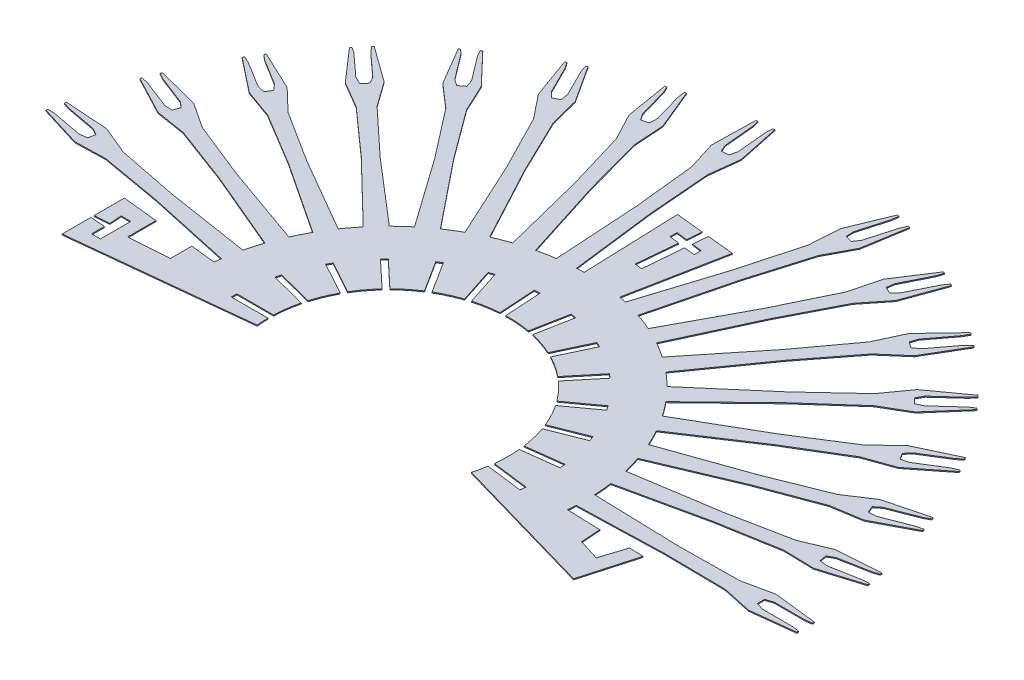
from build123d import *

# Parameters (mm, degrees)
SKETCH2_R               = 6.200163369
BOSS_EXTRUDE1_DEPTH     = 0.05
BOSS_EXTRUDE2_DEPTH     = 0.05
BOSS_EXTRUDE3_DEPTH     = 0.05
CIRPATTERN1_COUNT       = 18
CIRPATTERN1_ANGLE       = 180
CUT_EXTRUDE4_DEPTH      = 103.361408091
CUT_EXTRUDE4_DEPTH_BACK = 0.05
CUT_EXTRUDE6_DEPTH      = 103.361408091
CUT_EXTRUDE6_DEPTH_BACK = 0.05
CUT_EXTRUDE13_DEPTH     = 10
SKETCH13_R              = 2.29112386
SKETCH13_W              = 5.561420579
SKETCH13_H              = 0.286113496
CUT_EXTRUDE14_DEPTH     = 103.361408091


with BuildPart() as part:
    # Sketch2 → Boss-Extrude1 (new body)
    with BuildSketch(Plane(origin=(0, 0, 0), x_dir=(1, 0, 0), z_dir=(0, 1, 0))):
        with BuildLine():
            Line((41.736564116, 50.95828476), (36.555246465, 51.501399508))
            Line((36.555246465, 51.501399508), (36.555246465, 48.286890075))
            Line((36.555246465, 48.286890075), (41.732722408, 48.833722572))
            ThreePointArc((41.732722408, 48.833722572), (41.733244647, 48.828783324), (41.733769301, 48.82384433))
            ThreePointArc((41.733769301, 48.82384433), (50.963390645, 39.773597615), (61.612393233, 47.101054176))
            Line((61.612393233, 47.101054176), (66.500703475, 45.70083261))
            Line((66.500703475, 45.70083261), (67.011967053, 48.840095645))
            Line((67.011967053, 48.840095645), (61.960868148, 49.001189769))
            ThreePointArc((61.960868148, 49.001189769), (59.963353335, 56.003029367), (53.794021492, 59.87022057))
            Line((53.794021492, 59.87022057), (54.740102943, 64.742398272))
            Line((54.740102943, 64.742398272), (51.585987879, 65.064191003))
            Line((51.585987879, 65.064191003), (51.764987526, 60.059419928))
            ThreePointArc((51.764987526, 60.059419928), (45.016500937, 57.426340658), (41.737479755, 50.966991019))
            ThreePointArc((41.737479755, 50.966991019), (41.737020998, 50.962637988), (41.736564116, 50.95828476))
        make_face()
        with Locations(Location((51.841, 49.9, 0), (0, 0, 270))):
            Circle(SKETCH2_R, mode=Mode.SUBTRACT)
    extrude(amount=BOSS_EXTRUDE1_DEPTH)

    # Sketch3 → Boss-Extrude2 (add)
    with BuildSketch(Plane(origin=(0, 0, 0), x_dir=(1, 0, 0), z_dir=(0, 1, 0))):
        Polygon((32.238549372, 50.21), (30.656382721, 50.21), (30.312927172, 50.258547235), (30.312927172, 50.353802971), (32.548549372, 50.609778247), (34.08565504, 50.281862639), (37.255402915, 50.243744905), (41.857469478, 50.381755064), (41.857469478, 49.418244936), (37.255402915, 49.556255095), (34.08565504, 49.518137361), (32.548549372, 49.190221753), (30.312927172, 49.446197029), (30.312927172, 49.541452765), (30.656382721, 49.59), (32.238549372, 49.59), (32.615106949, 49.71386823), (32.615106949, 50.08613177), align=None)
    boss_extrude2 = extrude(amount=BOSS_EXTRUDE2_DEPTH)

    # CirPattern1: Boss-Extrude2 ×18 about axis
    cirpattern1_axis = Axis((51.841, 0, -49.9), (0, -1, 0))
    for i in range(1, CIRPATTERN1_COUNT):
        add(boss_extrude2.rotate(cirpattern1_axis, i * CIRPATTERN1_ANGLE / (CIRPATTERN1_COUNT - 1)))

    # Sketch8 → Cut-Extrude4 (cut, two sides: drawn at the far end of the back side and taken through both)
    with BuildSketch(Plane(origin=(0, 0, 0), x_dir=(1, 0, 0), z_dir=(0, 1, 0)).offset(-CUT_EXTRUDE4_DEPTH_BACK)):
        Polygon((36.555246465, 48.286890075), (27.995570216, 47.169676763), (27.995570216, 52.890741223), (36.555246465, 51.501399508), (36.555246465, 48.753981284), align=None)
        Polygon((51.655565612, 72.526598057), (51.585987879, 65.064191003), (54.740102943, 64.742398272), (56.406958129, 72.526598057), align=None)
        Polygon((47.95502979, 51.501399508), (46.998338953, 48.798), (52.839188276, 46.161429513), (54.740102943, 51.719098387), align=None)
    extrude(amount=CUT_EXTRUDE4_DEPTH + CUT_EXTRUDE4_DEPTH_BACK, mode=Mode.SUBTRACT)


with BuildPart() as body_2:
    # Sketch5 → Boss-Extrude3 (new body)
    with BuildSketch(Plane(origin=(0, 0, 0), x_dir=(1, 0, 0), z_dir=(0, 1, 0))):
        Polygon((51.841, 49.9), (51.841, 47.98601508), (47.518666367, 49.9), align=None)
    extrude(amount=BOSS_EXTRUDE3_DEPTH)


with BuildPart() as cut_extrude6_tool:
    # Sketch9 → Cut-Extrude6 (new, two sides: drawn at the far end of the back side and taken through both)
    with BuildSketch(Plane(origin=(0, 0, 0), x_dir=(1, 0, 0), z_dir=(0, 1, 0)).offset(-CUT_EXTRUDE6_DEPTH_BACK)):
        Polygon((36.555246465, 48.286890075), (47.009139853, 49.390092422), (47.587964148, 50.49093808), (51.841, 49.9), (66.500703475, 45.70083261), (51.841, 34.857894493), align=None)
    extrude(amount=CUT_EXTRUDE6_DEPTH + CUT_EXTRUDE6_DEPTH_BACK)


with BuildPart() as part_1:
    add(part.part)

    # Cut-Extrude6: cut by cut_extrude6_tool
    add(cut_extrude6_tool.part, mode=Mode.SUBTRACT)

    # Sketch12 → Cut-Extrude13 (cut)
    with BuildSketch(Plane(origin=(0, 0, 0), x_dir=(1, 0, 0), z_dir=(0, 1, 0))):
        Polygon((36.555246465, 51.501399508), (38.377437868, 51.501399508), (38.377437868, 49.846380566), (40.450129226, 49.985069668), (40.450129226, 51.16915959), (37.317153392, 51.720562063), align=None)
        Polygon((66.036768105, 49.006664529), (65.095153252, 45.671159721), (66.958125451, 45.145241638), (67.462296373, 48.891444034), align=None)
        Polygon((53.08254989, 66.12808357), (52.948117152, 64.171821775), (52.385771098, 64.24300482), (52.385771098, 63.878888302), (52.896048123, 63.814296274), (52.708350835, 61.754583122), (53.087715457, 61.700660527), (53.262410471, 63.755183921), (53.814395603, 63.698049757), (53.814395603, 64.054600552), (53.300329713, 64.12534266), (53.473842648, 66.014949594), align=None)
        Polygon((65.273932949, 48.895526569), (64.858820111, 47.588272269), (63.761063297, 47.936860104), (63.677982038, 49.064928372), (65.504842158, 49.006664529), align=None)
        Polygon((35.431152546, 49.858633501), (37.312510157, 49.997193872), (37.266298078, 50.624656446), (37.766087028, 50.624656446), (37.766087028, 49.051172586), (37.312510157, 49.051172586), (37.312510157, 49.715786798), align=None)
    extrude(amount=CUT_EXTRUDE13_DEPTH, mode=Mode.SUBTRACT)

    # Sketch13 → Cut-Extrude14 (cut, through all)
    with BuildSketch(Plane(origin=(0, 0, 0), x_dir=(1, 0, 0), z_dir=(0, 1, 0))):
        with Locations((51.841102424, 49.89933139)):
            Circle(SKETCH13_R)
        Polygon((49.373582939, 50.469956344), (43.986884615, 51.853025401), (44.058038148, 52.130150114), (49.444736472, 50.747081058), align=None)
        with Locations((46.528485657, 49.981438718)):
            Rectangle(SKETCH13_W, SKETCH13_H)
        Polygon((49.593013257, 51.065676254), (44.719503253, 53.744911051), (44.857339481, 53.995634219), (49.730849484, 51.316399422), align=None)
        Polygon((49.953699285, 51.588110427), (45.899598159, 55.395164789), (46.095456324, 55.603732551), (50.14955745, 51.796678189), align=None)
        Polygon((50.432977793, 52.004432402), (47.453019629, 56.700095102), (47.694593243, 56.853402379), (50.674551407, 52.157739679), align=None)
        Polygon((51.000733951, 52.288483138), (49.282160479, 57.577708419), (49.554270583, 57.666122351), (51.272844055, 52.37689707), align=None)
        Polygon((51.62129355, 52.422414683), (51.272089063, 57.972861068), (51.557637978, 57.990826284), (51.906842466, 52.440379898), align=None)
        Polygon((52.255664549, 52.397811626), (53.297770848, 57.860724156), (53.578816487, 57.807111833), (52.536710188, 52.344199303), align=None)
        Polygon((52.863987086, 52.216219866), (55.2319248, 57.248343656), (55.490808031, 57.126522455), (53.122870317, 52.094398665), align=None)
        Polygon((53.408038017, 51.889049483), (56.953020911, 56.174197688), (57.173475148, 55.991822082), (53.628492254, 51.706673877), align=None)
        Polygon((53.853632622, 51.436857795), (58.352916383, 54.705778792), (58.521089676, 54.474308112), (54.021805915, 51.205387114), align=None)
        Polygon((54.172772553, 50.888057667), (59.343650635, 52.93535313), (59.448976038, 52.66933153), (54.278097956, 50.622036067), align=None)
        Polygon((54.345405075, 50.277132232), (59.862972191, 50.974163056), (59.89883172, 50.690305651), (54.381264604, 49.993274827), align=None)
        Polygon((54.36068305, 49.64246818), (59.878250167, 48.945437356), (59.842390637, 48.66157995), (54.324823521, 49.358610775), align=None)
        Polygon((54.217646509, 49.023943788), (59.388524591, 46.976648325), (59.283199189, 46.710626725), (54.112321107, 48.757922188), align=None)
        Polygon((53.925282963, 48.460423219), (58.424566723, 45.191502221), (58.25639343, 44.960031541), (53.757109669, 48.228952539), align=None)
        Polygon((53.501962688, 47.987314542), (57.046945581, 43.702166338), (56.826491344, 43.519790732), (53.28150845, 47.804938936), align=None)
        Polygon((52.974284454, 47.634344916), (55.342222168, 42.602221126), (55.083338937, 42.480399925), (52.715401223, 47.512523714), align=None)
        Polygon((52.375404226, 47.423692719), (53.417510525, 41.960780189), (53.136464886, 41.907167866), (52.094358587, 47.370080396), align=None)
        Polygon((51.742951851, 47.368594006), (51.393747363, 41.81814762), (51.108198447, 41.836112835), (51.457402935, 47.386559221), align=None)
        Polygon((51.116666637, 47.472510829), (49.398093165, 42.183285548), (49.125983061, 42.271699481), (50.844556533, 47.560924762), align=None)
        Polygon((50.535900388, 47.728913714), (47.555942224, 43.033251014), (47.31436861, 43.186558291), (50.294326774, 47.882220991), align=None)
        Polygon((50.037144783, 48.121691923), (45.983043657, 44.314637561), (45.787185492, 44.523205323), (49.841286617, 48.330259685), align=None)
        Polygon((49.651738471, 48.626165758), (44.778228467, 45.946930961), (44.64039224, 46.197654128), (49.513902243, 48.876888925), align=None)
        Polygon((49.403897948, 49.210637272), (44.017199624, 47.827568216), (43.946046091, 48.10469293), (49.332744415, 49.487761986), align=None)
    extrude(amount=CUT_EXTRUDE14_DEPTH, mode=Mode.SUBTRACT)


with BuildPart() as body_2_1:
    add(body_2.part)

    # Cut-Extrude6: cut by cut_extrude6_tool
    add(cut_extrude6_tool.part, mode=Mode.SUBTRACT)


solid = part_1.part
